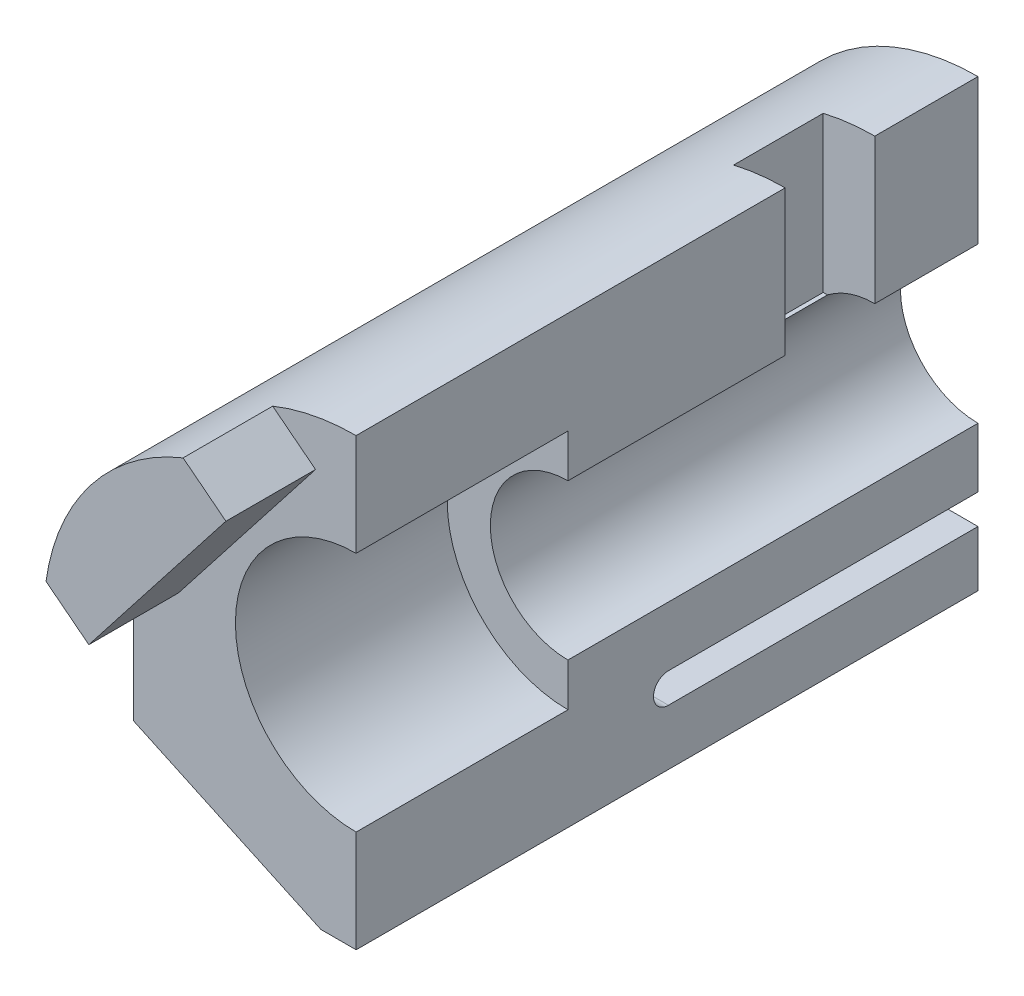
from build123d import *

# Parameters (mm, degrees)
BOSS_EXTRUDE1_DEPTH = 262
CUT_EXTRUDE3_START  = -33
CUT_EXTRUDE3_DEPTH  = 33
SKETCH4_R           = 44.45
CUT_EXTRUDE4_DEPTH  = 78
SKETCH6_W           = 33
SKETCH6_H           = 59.34931139
CUT_EXTRUDE6_DEPTH  = 19
SKETCH7_R           = 5.5
CUT_EXTRUDE7_DEPTH  = 13


with BuildPart() as part:
    # Sketch1 → Boss-Extrude1 (new body)
    with BuildSketch(Plane.XY):
        with BuildLine():
            Line((0, 0), (-13, 0))
            Line((-13, 0), (-82, 32.051995773))
            Line((-82, 32.051995773), (-82, 82))
            ThreePointArc((-82, 82), (-57.982756057, 139.982756057), (0, 164))
            Line((0, 164), (0, 110.575))
            ThreePointArc((0, 110.575), (-28.575, 82), (0, 53.425))
            Line((0, 53.425), (0, 0))
        make_face()
    extrude(amount=BOSS_EXTRUDE1_DEPTH)

    # Sketch2 → Cut-Extrude3 (cut)
    with BuildSketch(Plane.XY.offset(262).offset(CUT_EXTRUDE3_START)):
        with BuildLine():
            Line((0, 53.425), (0, 0))
            Line((0, 0), (-13, 0))
            Line((-13, 0), (-82, 32.051995773))
            Line((-82, 32.051995773), (-82, 82))
            ThreePointArc((-82, 82), (-81.800252121, 87.720030847), (-81.201981637, 93.412194279))
            Line((-81.201981637, 93.412194279), (-65.430668922, 81.090294344))
            Line((-65.430668922, 81.090294344), (-14.946427946, 145.707176139))
            Line((-14.946427946, 145.707176139), (-30.71774066, 158.029076074))
            ThreePointArc((-30.71774066, 158.029076074), (-15.646337621, 162.493429043), (0, 164))
            Line((0, 164), (0, 110.575))
            ThreePointArc((0, 110.575), (-28.575, 82), (0, 53.425))
        make_face()
    extrude(amount=CUT_EXTRUDE3_DEPTH, mode=Mode.SUBTRACT)

    # Sketch4 → Cut-Extrude4 (cut)
    with BuildSketch(Plane.XY.offset(229)):
        with Locations((0, 82)):
            Circle(SKETCH4_R)
    extrude(amount=-CUT_EXTRUDE4_DEPTH, mode=Mode.SUBTRACT)

    # Sketch6 → Cut-Extrude6 (cut)
    with BuildSketch(Plane(origin=(0, 0, 0), x_dir=(0, 0, -1), z_dir=(1, 0, 0))):
        with Locations((-54.5, 134.325344305)):
            Rectangle(SKETCH6_W, SKETCH6_H)
    extrude(amount=-CUT_EXTRUDE6_DEPTH, mode=Mode.SUBTRACT)

    # Sketch7 → Cut-Extrude7 (cut)
    with BuildSketch(Plane(origin=(0, 0, 0), x_dir=(0, 0, -1), z_dir=(1, 0, 0))):
        with BuildLine():
            ThreePointArc((-108.5, 26), (-110.110912703, 22.110912703), (-114, 20.5))
            Line((-114, 20.5), (0, 20.5))
            Line((0, 20.5), (0, 31.5))
            Line((0, 31.5), (-114, 31.5))
            ThreePointArc((-114, 31.5), (-110.110912703, 29.889087297), (-108.5, 26))
        make_face()
        with Locations((-114, 26)):
            Circle(SKETCH7_R)
    extrude(amount=-CUT_EXTRUDE7_DEPTH, mode=Mode.SUBTRACT)


solid = part.part
